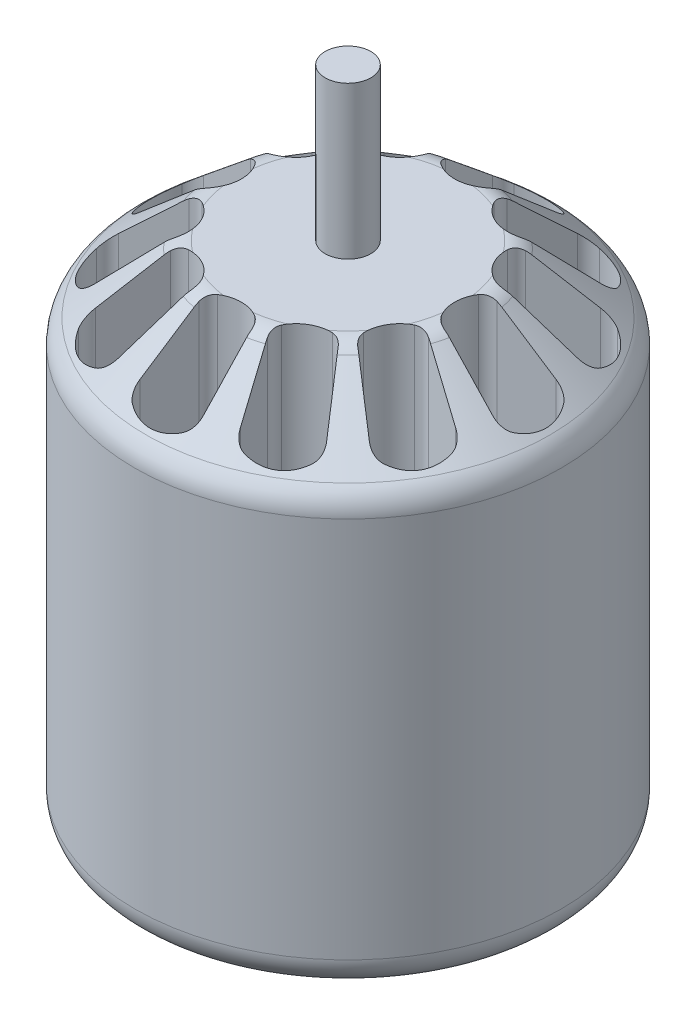
from build123d import *

# Parameters (mm, degrees)
FILLET_1_R               = 2
CUT_EXTRUDE_1_DEPTH      = 39.483762883
PATTERN_CIRCULAR_1_COUNT = 12
SKETCH_3_R               = 5
CUT_EXTRUDE_2_DEPTH      = 2
SKETCH_4_R               = 1.5
EXTRUDE_1_DEPTH          = 10


with BuildPart() as part:
    # 草圖1 → 旋轉1 (revolve)
    with BuildSketch(Plane.XY):
        Polygon((8, 33), (0, 33), (0, 0), (14, 0), (14, 28), align=None)
    revolve(axis=Axis((0, 35.352738226, 0), (0, -1, 0)))

    # 圓角1
    fillet_1_edges = [part.edges().sort_by_distance(p)[0] for p in [
        (-14, 0, 0),
        (-14, 28, 0),
        (-8, 33, 0),
    ]]
    fillet(fillet_1_edges, radius=FILLET_1_R)

    # 草圖2 → 除料-伸長1 (cut, through all)
    with BuildSketch(Plane(origin=(0, 33, 0), x_dir=(1, 0, 0), z_dir=(0, 1, 0))):
        with BuildLine():
            Line((-2.074684785, 11.573497242), (-1.691121257, 8.088230344))
            ThreePointArc((-1.691121257, 8.088230344), (-1.542263278, 7.663078753), (-1.221915632, 7.346392854))
            ThreePointArc((-1.221915632, 7.346392854), (0, 7), (1.221915632, 7.346392854))
            ThreePointArc((1.221915632, 7.346392854), (1.542263278, 7.663078753), (1.691121257, 8.088230344))
            Line((1.691121257, 8.088230344), (2.074684785, 11.573497242))
            ThreePointArc((2.074684785, 11.573497242), (1.983223653, 12.113500855), (1.621029209, 12.524334428))
            ThreePointArc((1.621029209, 12.524334428), (0, 13), (-1.621029209, 12.524334428))
            ThreePointArc((-1.621029209, 12.524334428), (-1.983223653, 12.113500855), (-2.074684785, 11.573497242))
        make_face()
    cut_extrude_1 = extrude(amount=-CUT_EXTRUDE_1_DEPTH, mode=Mode.SUBTRACT)

    # 環狀複製排列1: 除料-伸長1 ×12 about axis
    pattern_circular_1_axis = Axis((0, 34.65, 0), (0, -1, 0))
    for i in range(1, PATTERN_CIRCULAR_1_COUNT):
        add(cut_extrude_1.rotate(pattern_circular_1_axis, i * 360 / PATTERN_CIRCULAR_1_COUNT), mode=Mode.SUBTRACT)

    # 草圖3 → 除料-伸長2 (cut)
    with BuildSketch(Plane.XZ):
        Circle(SKETCH_3_R)
    extrude(amount=-CUT_EXTRUDE_2_DEPTH, mode=Mode.SUBTRACT)

    # 草圖4 → 填料-伸長1 (add)
    with BuildSketch(Plane(origin=(0, 33, 0), x_dir=(1, 0, 0), z_dir=(0, 1, 0))):
        Circle(SKETCH_4_R)
    extrude(amount=EXTRUDE_1_DEPTH)


solid = part.part
